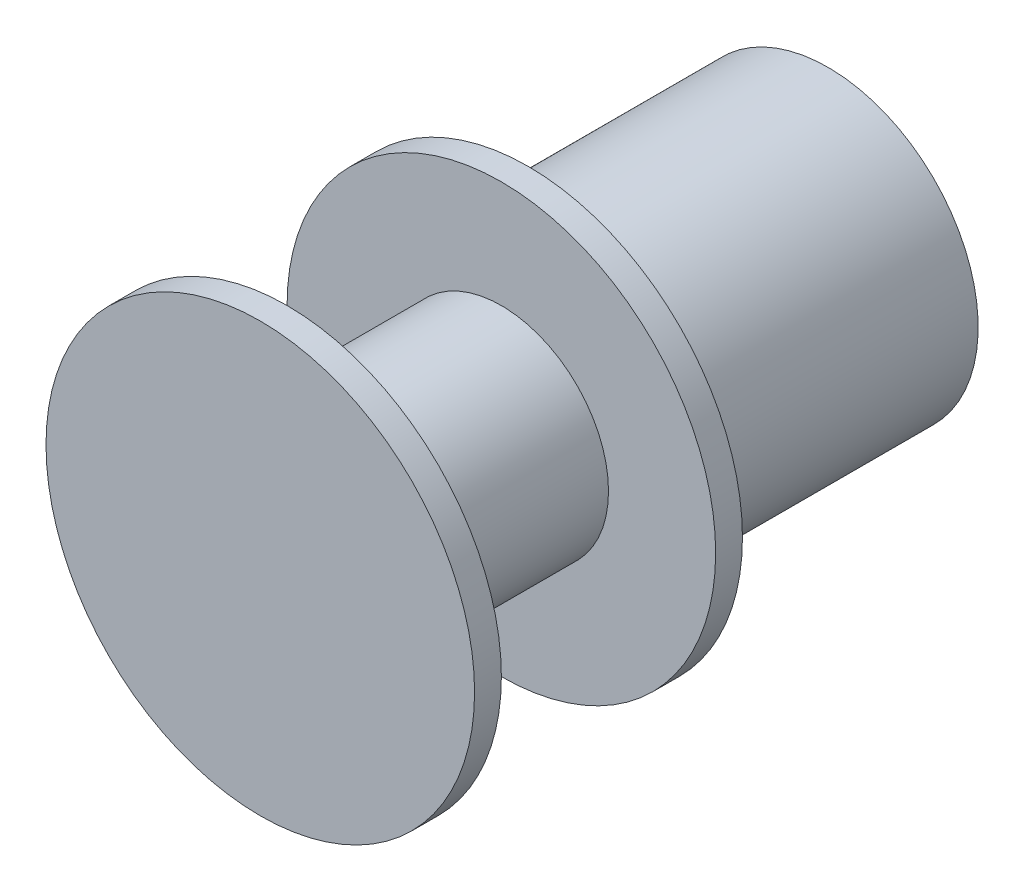
from build123d import *

# Parameters (mm, degrees)
SKETCH1_R           = 6.35
BOSS_EXTRUDE1_DEPTH = 0.79375
SKETCH2_R           = 3.175
BOSS_EXTRUDE2_DEPTH = 6.35
SKETCH3_R           = 6.35
BOSS_EXTRUDE3_DEPTH = 0.79375
SKETCH4_R           = 4.445
BOSS_EXTRUDE4_DEPTH = 8.89
SKETCH5_R           = 3.175
CUT_EXTRUDE1_DEPTH  = 3.175


with BuildPart() as part:
    # Sketch1 → Boss-Extrude1 (new body)
    with BuildSketch(Plane.XY):
        Circle(SKETCH1_R)
    extrude(amount=BOSS_EXTRUDE1_DEPTH)

    # Sketch2 → Boss-Extrude2 (add)
    with BuildSketch(Plane.XY.offset(0.79375)):
        Circle(SKETCH2_R)
    extrude(amount=BOSS_EXTRUDE2_DEPTH)

    # Sketch3 → Boss-Extrude3 (add)
    with BuildSketch(Plane.XY.offset(7.14375)):
        Circle(SKETCH3_R)
    extrude(amount=BOSS_EXTRUDE3_DEPTH)

    # Sketch4 → Boss-Extrude4 (add)
    with BuildSketch(Plane(origin=(0, 0, 0), x_dir=(-1, 0, 0), z_dir=(0, 0, -1))):
        Circle(SKETCH4_R)
    extrude(amount=BOSS_EXTRUDE4_DEPTH)

    # Sketch5 → Cut-Extrude1 (cut)
    with BuildSketch(Plane(origin=(0, 0, -8.89), x_dir=(-1, 0, 0), z_dir=(0, 0, -1))):
        with Locations(Location((0, 0, 0), (0, 0, 180))):
            Circle(SKETCH5_R)
    extrude(amount=-CUT_EXTRUDE1_DEPTH, mode=Mode.SUBTRACT)


solid = part.part
